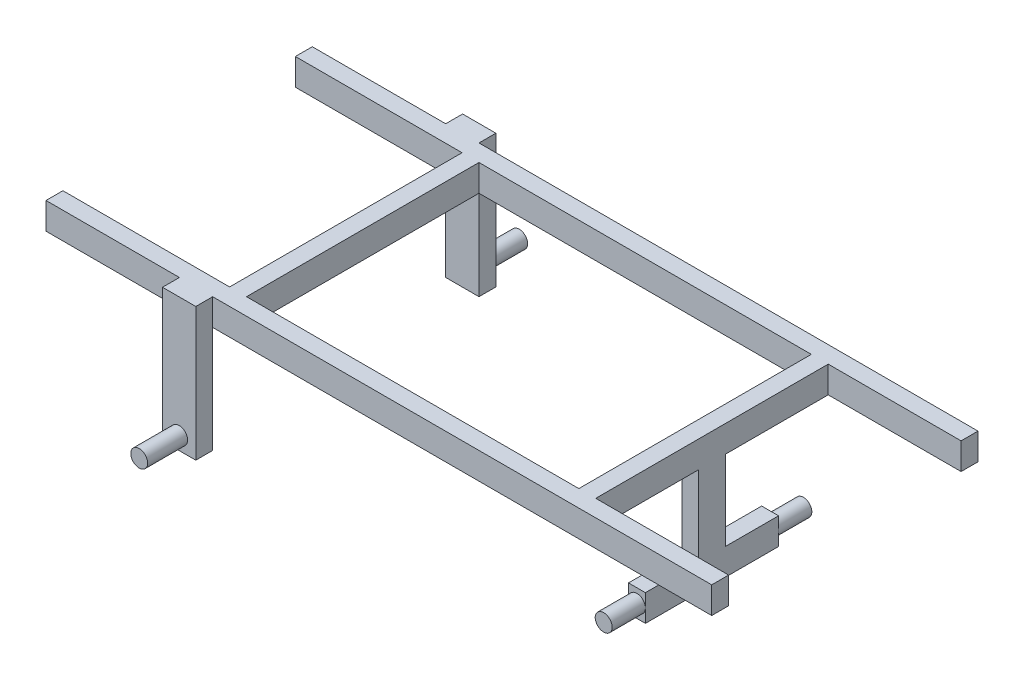
from build123d import *

# Parameters (mm, degrees)
CROQUIS1_W              = 50.8
CROQUIS1_H              = 50.8
CROQUIS1_W_2            = 399.2
CROQUIS1_H_2            = 149.2
CROQUIS1_H_3            = 160
CROQUIS1_H_4            = 80
CROQUIS1_H_5            = 698.4
CROQUIS1_W_3            = 100
SALIENTE_EXTRUIR1_DEPTH = 80
CROQUIS1_4_W            = 100
CROQUIS1_4_H            = 50.8
CROQUIS1_4_W_2          = 50.8
CROQUIS1_4_H_2          = 80
SALIENTE_EXTRUIR2_DEPTH = 320
SALIENTE_EXTRUIR3_START = -320
CROQUIS1_5_W            = 50.8
CROQUIS1_5_H            = 160
CROQUIS1_5_H_2          = 80
SALIENTE_EXTRUIR3_DEPTH = 80
SALIENTE_EXTRUIR4_START = 450.8
CROQUIS2_R              = 25.4
SALIENTE_EXTRUIR4_DEPTH = 120
SALIENTE_EXTRUIR5_START = -570.8
CROQUIS2_7_R            = 25.4
SALIENTE_EXTRUIR5_DEPTH = 120
CROQUIS2_8_R            = 25.4
SALIENTE_EXTRUIR6_DEPTH = 300


with BuildPart() as part:
    # Croquis1 → Saliente-Extruir1 (new body)
    with BuildSketch(Plane(origin=(0, 0, 0), x_dir=(1, 0, 0), z_dir=(0, 1, 0))):
        Polygon((-1000, 400), (-1000, 349.2), (-499.2, 349.2), (-499.2, 400), (-599.2, 400), align=None)
        with Locations((-473.8, 374.6)):
            Rectangle(CROQUIS1_W, CROQUIS1_H)
        Polygon((-448.4, 400), (-448.4, 349.2), (0, 349.2), (550, 349.2), (550, 400), align=None)
        with Locations((800.4, 374.6)):
            Rectangle(CROQUIS1_W_2, CROQUIS1_H)
        with Locations((575.4, 374.6)):
            Rectangle(CROQUIS1_W, CROQUIS1_H)
        with Locations((575.4, 274.6)):
            Rectangle(CROQUIS1_W, CROQUIS1_H_2)
        with Locations((575.4, 120)):
            Rectangle(CROQUIS1_W, CROQUIS1_H_3)
        with Locations((575.4, 0)):
            Rectangle(CROQUIS1_W, CROQUIS1_H_4)
        with Locations((575.4, -120)):
            Rectangle(CROQUIS1_W, CROQUIS1_H_3)
        with Locations((575.4, -274.6)):
            Rectangle(CROQUIS1_W, CROQUIS1_H_2)
        with Locations((575.4, -374.6)):
            Rectangle(CROQUIS1_W, CROQUIS1_H)
        with Locations((800.4, -374.6)):
            Rectangle(CROQUIS1_W_2, CROQUIS1_H)
        Polygon((0, -349.2), (-448.4, -349.2), (-448.4, -400), (550, -400), (550, -349.2), align=None)
        with Locations((-473.8, -374.6)):
            Rectangle(CROQUIS1_W, CROQUIS1_H)
        Polygon((-499.2, -400), (-499.2, -349.2), (-1000, -349.2), (-1000, -400), (-599.2, -400), align=None)
        with Locations((-473.8, 0)):
            Rectangle(CROQUIS1_W, CROQUIS1_H_5)
        with Locations((-549.2, 425.4)):
            Rectangle(CROQUIS1_W_3, CROQUIS1_H)
        with Locations((-549.2, -425.4)):
            Rectangle(CROQUIS1_W_3, CROQUIS1_H)
    extrude(amount=SALIENTE_EXTRUIR1_DEPTH)

    # Croquis1<4> → Saliente-Extruir2 (add)
    with BuildSketch(Plane(origin=(0, 0, 0), x_dir=(1, 0, 0), z_dir=(0, 1, 0))):
        with Locations((-549.2, -425.4)):
            Rectangle(CROQUIS1_4_W, CROQUIS1_4_H)
        with Locations((-549.2, 425.4)):
            Rectangle(CROQUIS1_4_W, CROQUIS1_4_H)
        with Locations((575.4, 0)):
            Rectangle(CROQUIS1_4_W_2, CROQUIS1_4_H_2)
    extrude(amount=-SALIENTE_EXTRUIR2_DEPTH)

    # Croquis1<5> → Saliente-Extruir3 (add)
    with BuildSketch(Plane(origin=(0, 0, 0), x_dir=(1, 0, 0), z_dir=(0, 1, 0)).offset(SALIENTE_EXTRUIR3_START)):
        with Locations((575.4, -120)):
            Rectangle(CROQUIS1_5_W, CROQUIS1_5_H)
        with Locations((575.4, 0)):
            Rectangle(CROQUIS1_5_W, CROQUIS1_5_H_2)
        with Locations((575.4, 120)):
            Rectangle(CROQUIS1_5_W, CROQUIS1_5_H)
    extrude(amount=SALIENTE_EXTRUIR3_DEPTH)

    # Croquis2 → Saliente-Extruir4 (add)
    with BuildSketch(Plane.XY.offset(SALIENTE_EXTRUIR4_START)):
        with Locations((-549.2, -280)):
            Circle(CROQUIS2_R)
    extrude(amount=SALIENTE_EXTRUIR4_DEPTH)

    # Croquis2<7> → Saliente-Extruir5 (add)
    with BuildSketch(Plane.XY.offset(SALIENTE_EXTRUIR5_START)):
        with Locations((-549.2, -280)):
            Circle(CROQUIS2_7_R)
    extrude(amount=SALIENTE_EXTRUIR5_DEPTH)

    # Croquis2<8> → Saliente-Extruir6 (add, symmetric)
    with BuildSketch(Plane.XY):
        with Locations((575.4, -280)):
            Circle(CROQUIS2_8_R)
    extrude(amount=SALIENTE_EXTRUIR6_DEPTH, both=True)


solid = part.part
